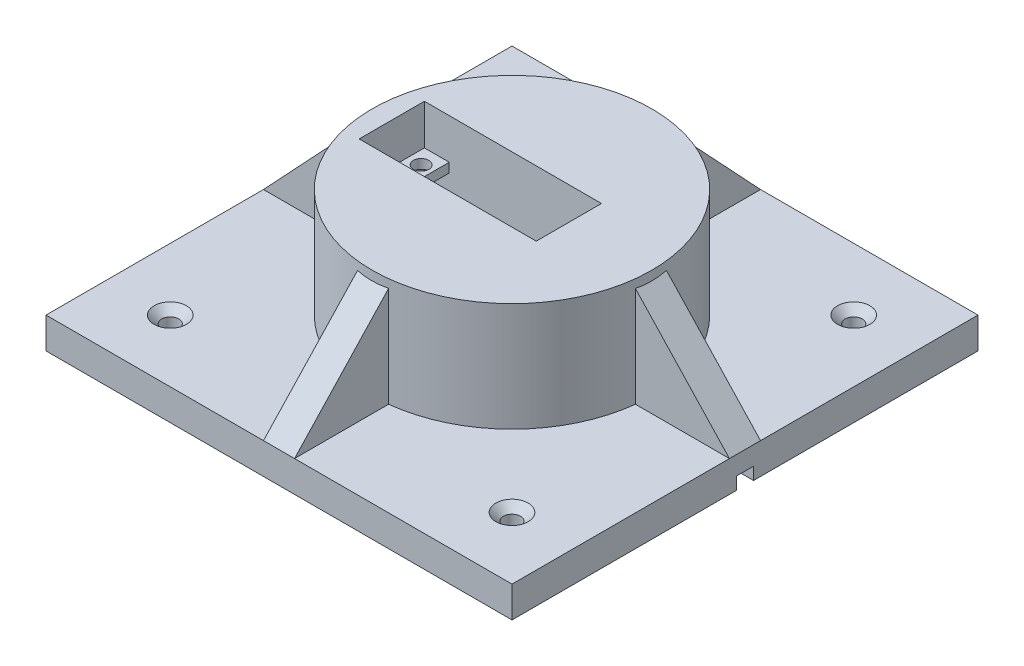
from build123d import *

# Parameters (mm, degrees)
SKETCH1_W                                           = 150
SKETCH1_H                                           = 150
BOSS_EXTRUDE1_DEPTH                                 = 10
SKETCH2_R                                           = 45
SKETCH2_W                                           = 41
SKETCH2_H                                           = 21
BOSS_EXTRUDE2_DEPTH                                 = 35
SKETCH3_W                                           = 57
SKETCH3_H                                           = 21
CUT_EXTRUDE1_DEPTH                                  = 13
SKETCH5_W                                           = 57
SKETCH5_H                                           = 21
CUT_EXTRUDE3_DEPTH                                  = 29
RIB5_REACH                                          = 117.217
SKETCH6_WALL_W                                      = 276.297796834
SKETCH6_WALL_H                                      = 10
CIRPATTERN1_COUNT                                   = 4
CSK_FOR_M5_COUNTERSUNK_FLAT_HEAD_SCREW1_D           = 5.5
CSK_FOR_M5_COUNTERSUNK_FLAT_HEAD_SCREW1_CSINK_D     = 10.4
CSK_FOR_M5_COUNTERSUNK_FLAT_HEAD_SCREW1_CSINK_ANGLE = 90
SKETCH12_R                                          = 2.5
CUT_EXTRUDE4_DEPTH                                  = 10
CUT_EXTRUDE5_DEPTH                                  = 144.449259322
CUT_EXTRUDE5_DEPTH_BACK                             = 144.449259322
SKETCH13_W                                          = 5.5
SKETCH13_H                                          = 4


with BuildPart() as part:
    # Sketch1 → Boss-Extrude1 (new body)
    with BuildSketch(Plane(origin=(0, 0, 0), x_dir=(1, 0, 0), z_dir=(0, 1, 0))):
        Rectangle(SKETCH1_W, SKETCH1_H)
    extrude(amount=BOSS_EXTRUDE1_DEPTH)

    # Sketch2 → Boss-Extrude2 (add)
    with BuildSketch(Plane(origin=(0, 10, 0), x_dir=(1, 0, 0), z_dir=(0, 1, 0))):
        with Locations(Location((0, 0, 0), (0, 0, 270))):
            Circle(SKETCH2_R)
        with Locations((-10.2, 0)):
            Rectangle(SKETCH2_W, SKETCH2_H, mode=Mode.SUBTRACT)
    extrude(amount=BOSS_EXTRUDE2_DEPTH)

    # Sketch3 → Cut-Extrude1 (cut)
    with BuildSketch(Plane(origin=(0, 45, 0), x_dir=(1, 0, 0), z_dir=(0, 1, 0))):
        with Locations((-10.2, 0)):
            Rectangle(SKETCH3_W, SKETCH3_H)
    extrude(amount=-CUT_EXTRUDE1_DEPTH, mode=Mode.SUBTRACT)

    # Sketch5 → Cut-Extrude3 (cut)
    with BuildSketch(Plane.XZ):
        with Locations((-10.2, 0)):
            Rectangle(SKETCH5_W, SKETCH5_H)
    extrude(amount=-CUT_EXTRUDE3_DEPTH, mode=Mode.SUBTRACT)

    # Sketch6 wall → Rib5 (add, up to next)
    with BuildSketch(Plane(origin=(0, 26, -60), x_dir=(0, -0.72953720414, -0.683941128881), z_dir=(0, 0.683941128881, -0.72953720414)), mode=Mode.PRIVATE) as rib5_sk1:
        Rectangle(SKETCH6_WALL_W, SKETCH6_WALL_H)
    rib5_tool1 = extrude(rib5_sk1.sketch, amount=-RIB5_REACH, mode=Mode.PRIVATE) - part.part
    rib5 = rib5_tool1.solids().sort_by_distance((0, 26, -60))[0]
    add(rib5)

    # CirPattern1: Rib5 ×4 about axis
    cirpattern1_axis = Axis((0, 0, 0), (0, 1, 0))
    for i in range(1, CIRPATTERN1_COUNT):
        add(rib5.rotate(cirpattern1_axis, i * 360 / CIRPATTERN1_COUNT))

    # CSK for M5 Countersunk Flat Head Screw1 (through all)
    with Locations(Plane(origin=(0, 10, 0), x_dir=(1, 0, 0), z_dir=(0, 1, 0))):
        with Locations((55, -55), (-55, -55), (-55, 55), (55, 55)):
            CounterSinkHole(CSK_FOR_M5_COUNTERSUNK_FLAT_HEAD_SCREW1_D / 2, CSK_FOR_M5_COUNTERSUNK_FLAT_HEAD_SCREW1_CSINK_D / 2, counter_sink_angle=CSK_FOR_M5_COUNTERSUNK_FLAT_HEAD_SCREW1_CSINK_ANGLE)

    # Sketch12 → Cut-Extrude4 (cut)
    with BuildSketch(Plane(origin=(0, 32, 0), x_dir=(1, 0, 0), z_dir=(0, 1, 0))):
        with Locations(Location((-34.5, 5.25, 0), (0, 0, 270))):
            Circle(SKETCH12_R)
        with Locations(Location((-34.5, -4.75, 0), (0, 0, 270))):
            Circle(SKETCH12_R)
        with Locations(Location((14.5, 5.25, 0), (0, 0, 270))):
            Circle(SKETCH12_R)
        with Locations(Location((14.5, -5, 0), (0, 0, 270))):
            Circle(SKETCH12_R)
    extrude(amount=-CUT_EXTRUDE4_DEPTH, mode=Mode.SUBTRACT)

    # Sketch13 → Cut-Extrude5 (cut, two sides: drawn at the far end of the back side and taken through both)
    with BuildSketch(Plane(origin=(-38.7, 0, 0), x_dir=(0, 0, -1), z_dir=(1, 0, 0)).offset(-CUT_EXTRUDE5_DEPTH_BACK)):
        with Locations((0, 2)):
            Rectangle(SKETCH13_W, SKETCH13_H)
    extrude(amount=CUT_EXTRUDE5_DEPTH + CUT_EXTRUDE5_DEPTH_BACK, mode=Mode.SUBTRACT)


solid = part.part
